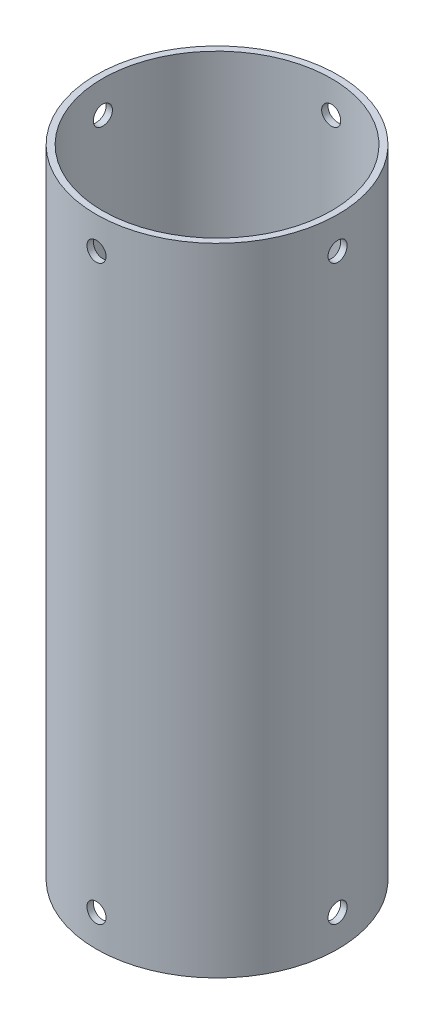
from build123d import *

# Parameters (mm, degrees)
SKETCH1_R               = 19
SKETCH1_R_2             = 18
BOSS_EXTRUDE1_DEPTH     = 100
CUT_EXTRUDE1_DEPTH      = 104.547090737
CUT_EXTRUDE1_DEPTH_BACK = 104.547090737
SKETCH2_R               = 1.5
CUT_EXTRUDE2_DEPTH      = 104.54709087
CUT_EXTRUDE2_DEPTH_BACK = 104.54709087
SKETCH3_R               = 1.5


with BuildPart() as part:
    # Sketch1 → Boss-Extrude1 (new body)
    with BuildSketch(Plane(origin=(0, 0, 0), x_dir=(1, 0, 0), z_dir=(0, 1, 0))):
        with Locations(Location((0, 0, 0), (0, 0, 270))):
            Circle(SKETCH1_R)
        with Locations(Location((0, 0, 0), (0, 0, 270))):
            Circle(SKETCH1_R_2, mode=Mode.SUBTRACT)
    extrude(amount=BOSS_EXTRUDE1_DEPTH)

    # Sketch2 → Cut-Extrude1 (cut, two sides: drawn at the far end of the back side and taken through both)
    with BuildSketch(Plane.XY.offset(-CUT_EXTRUDE1_DEPTH_BACK)):
        with Locations((0, 95)):
            Circle(SKETCH2_R)
        with Locations((0, 5)):
            Circle(SKETCH2_R)
    extrude(amount=CUT_EXTRUDE1_DEPTH + CUT_EXTRUDE1_DEPTH_BACK, mode=Mode.SUBTRACT)

    # Sketch3 → Cut-Extrude2 (cut, two sides: drawn at the far end of the back side and taken through both)
    with BuildSketch(Plane(origin=(0, 0, 0), x_dir=(0, 0, -1), z_dir=(1, 0, 0)).offset(-CUT_EXTRUDE2_DEPTH_BACK)):
        with Locations((0, 5)):
            Circle(SKETCH3_R)
        with Locations((0, 95)):
            Circle(SKETCH3_R)
    extrude(amount=CUT_EXTRUDE2_DEPTH + CUT_EXTRUDE2_DEPTH_BACK, mode=Mode.SUBTRACT)


solid = part.part
